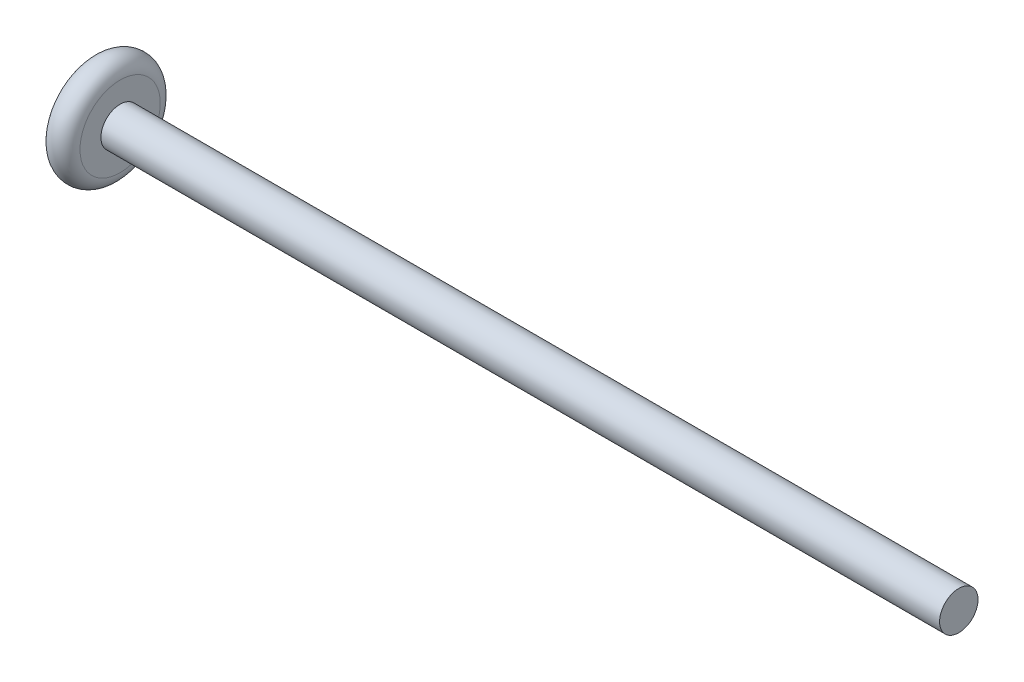
from build123d import *


with BuildPart() as part:
    # Skizze1 → Rotation1 (revolve)
    with BuildSketch(Plane.XY, mode=Mode.PRIVATE) as rotation1_sk:
        with BuildLine():
            Line((0, 0), (0, 4.7))
            ThreePointArc((0, 4.7), (1.65, 6.35), (3.3, 4.7))
            Line((3.3, 4.7), (3.3, 2.25))
            Line((3.3, 2.25), (101.5, 2.25))
            Line((101.5, 2.25), (101.5, 0))
            Line((101.5, 0), (0, 0))
        make_face()
    revolve(rotation1_sk.sketch.rotate(Axis((0, 0, 0), (1, 0, 0)), 90), axis=Axis((0, 0, 0), (1, 0, 0)))


solid = part.part
